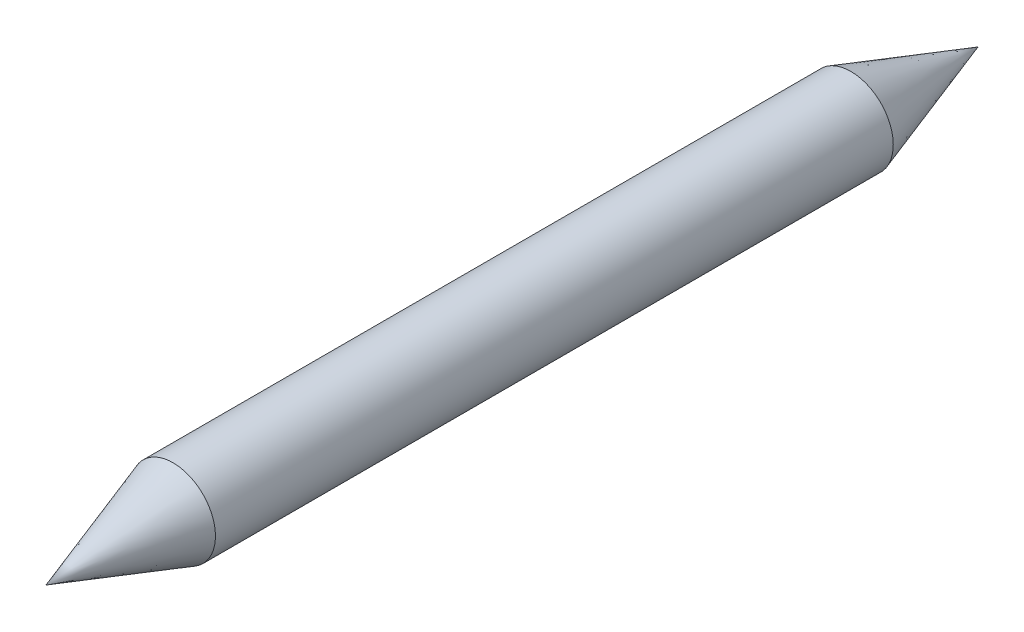
from build123d import *

# Parameters (mm, degrees)
SKETCH1_R           = 10
SKETCH1_R_2         = 9
BOSS_EXTRUDE1_DEPTH = 160
SKETCH3_R           = 10
SKETCH7_R           = 10


with BuildPart() as part:
    # Sketch1 → Boss-Extrude1 (new body)
    with BuildSketch(Plane.XY):
        Circle(SKETCH1_R)
        Circle(SKETCH1_R_2, mode=Mode.SUBTRACT)
    extrude(amount=-BOSS_EXTRUDE1_DEPTH)

    # Sketch3 → Loft3 section 0
    with BuildSketch(Plane.XY, mode=Mode.PRIVATE) as loft3_s0:
        Circle(SKETCH3_R)
    loft([loft3_s0.sketch, Vertex(0, 0, 30)])

    # Sketch7 → Loft4 section 0
    with BuildSketch(Plane(origin=(0, 0, -160), x_dir=(-1, 0, 0), z_dir=(0, 0, -1)), mode=Mode.PRIVATE) as loft4_s0:
        Circle(SKETCH7_R)
    loft([loft4_s0.sketch, Vertex(0, 0, -190)])


solid = part.part
